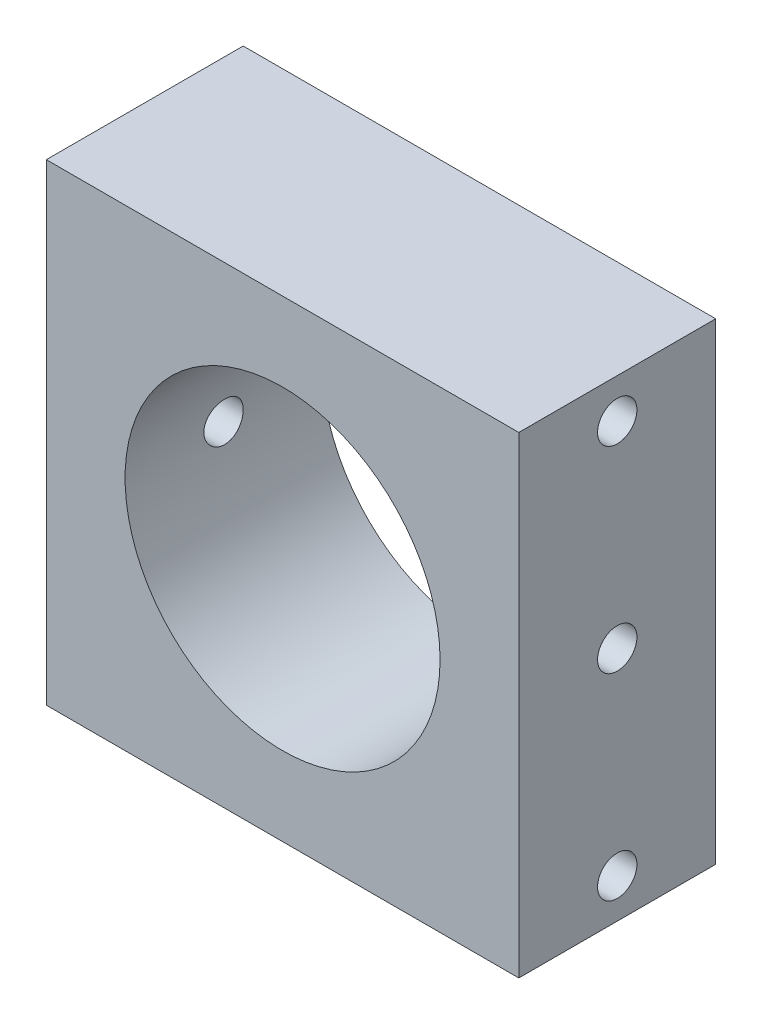
from build123d import *

# Parameters (mm, degrees)
BOSS_EXTRUDE1_DEPTH = 25
SKETCH2_R           = 2.5
CUT_EXTRUDE1_DEPTH  = 72.589105316


with BuildPart() as part:
    # Sketch1 → Boss-Extrude1 (new body)
    with BuildSketch(Plane.XY):
        with BuildLine():
            Line((-30, 0), (-20, 0))
            ThreePointArc((-20, 0), (0, 20), (20, 0))
            Line((20, 0), (30, 0))
            Line((30, 0), (30, 30))
            Line((30, 30), (-30, 30))
            Line((-30, 30), (-30, 0))
        make_face()
        with BuildLine():
            ThreePointArc((20, 0), (0, -20), (-20, 0))
            Line((-20, 0), (-30, 0))
            Line((-30, 0), (-30, -30))
            Line((-30, -30), (30, -30))
            Line((30, -30), (30, 0))
            Line((30, 0), (20, 0))
        make_face()
    extrude(amount=BOSS_EXTRUDE1_DEPTH)

    # Sketch2 → Cut-Extrude1 (cut, through all)
    with BuildSketch(Plane(origin=(30, 0, 0), x_dir=(0, 0, -1), z_dir=(1, 0, 0))):
        with Locations((-12.5, 25)):
            Circle(SKETCH2_R)
        with Locations((-12.5, -25)):
            Circle(SKETCH2_R)
        with Locations((-12.5, 0)):
            Circle(SKETCH2_R)
    extrude(amount=-CUT_EXTRUDE1_DEPTH, mode=Mode.SUBTRACT)


solid = part.part
